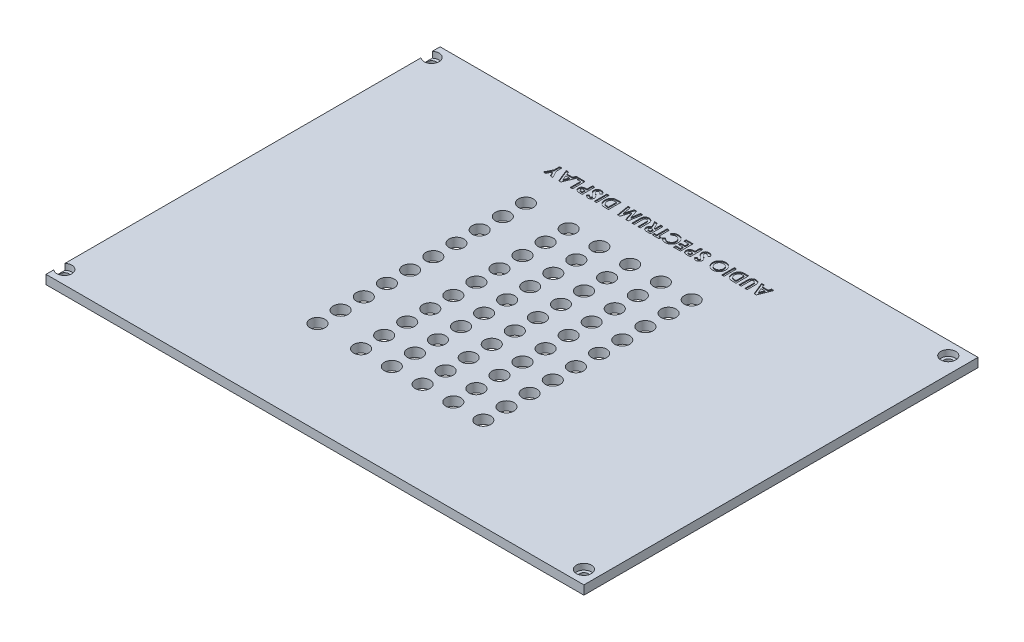
from build123d import *

# Parameters (mm, degrees)
SKETCH1_W           = 180.16
SKETCH1_H           = 132
BOSS_EXTRUDE1_DEPTH = 3
SKETCH2_R           = 2.5
CUT_EXTRUDE1_DEPTH  = 2
SKETCH3_R           = 1.5
CUT_EXTRUDE2_DEPTH  = 2
SKETCH4_R           = 2.5
CUT_EXTRUDE3_DEPTH  = 12
SKETCH6_R           = 2.5
CUT_EXTRUDE4_DEPTH  = 12
SKETCH11_R          = 2.5
CUT_EXTRUDE8_DEPTH  = 12
SKETCH12_W          = 0.75982906
SKETCH12_H          = 4.233333334
SKETCH12_W_2        = 0.759829059
CUT_EXTRUDE9_DEPTH  = 0.3


with BuildPart() as part:
    # Sketch1 → Boss-Extrude1 (new body)
    with BuildSketch(Plane(origin=(0, 0, 0), x_dir=(1, 0, 0), z_dir=(0, 1, 0))):
        Rectangle(SKETCH1_W, SKETCH1_H)
    extrude(amount=BOSS_EXTRUDE1_DEPTH)

    # Sketch2 → Cut-Extrude1 (cut)
    with BuildSketch(Plane(origin=(0, 3, 0), x_dir=(1, 0, 0), z_dir=(0, 1, 0))):
        with Locations((-88.42, 61.5)):
            Circle(SKETCH2_R)
        with Locations(Location((84.621811473, 61.5, 0), (0, 0, 270))):
            Circle(SKETCH2_R)
        with Locations(Location((85.58, -61.5, 0), (0, 0, 270))):
            Circle(SKETCH2_R)
        with Locations((-88.42, -61.5)):
            Circle(SKETCH2_R)
    extrude(amount=-CUT_EXTRUDE1_DEPTH, mode=Mode.SUBTRACT)

    # Sketch3 → Cut-Extrude2 (cut)
    with BuildSketch(Plane(origin=(0, 1, 0), x_dir=(1, 0, 0), z_dir=(0, 1, 0))):
        with Locations(Location((-88.42, 61.5, 0), (0, 0, 270))):
            Circle(SKETCH3_R)
        with Locations(Location((84.621811473, 61.5, 0), (0, 0, 270))):
            Circle(SKETCH3_R)
        with Locations(Location((85.58, -61.5, 0), (0, 0, 270))):
            Circle(SKETCH3_R)
        with Locations(Location((-88.42, -61.5, 0), (0, 0, 270))):
            Circle(SKETCH3_R)
    extrude(amount=-CUT_EXTRUDE2_DEPTH, mode=Mode.SUBTRACT)

    # Sketch4 → Cut-Extrude3 (cut)
    with BuildSketch(Plane(origin=(0, 3, 0), x_dir=(1, 0, 0), z_dir=(0, 1, 0))):
        with Locations(Location((-15.729729156, 34.699227975, 0), (0, 0, 270))):
            Circle(SKETCH4_R)
        with Locations(Location((-15.729729156, 26.97510648, 0), (0, 0, 270))):
            Circle(SKETCH4_R)
        with Locations(Location((-15.729729156, 19.250984984, 0), (0, 0, 270))):
            Circle(SKETCH4_R)
        with Locations(Location((-15.729729156, 11.526863489, 0), (0, 0, 270))):
            Circle(SKETCH4_R)
        with Locations(Location((-15.729729156, 3.802741993, 0), (0, 0, 270))):
            Circle(SKETCH4_R)
        with Locations(Location((-15.729729156, -3.921379502, 0), (0, 0, 270))):
            Circle(SKETCH4_R)
        with Locations(Location((-15.729729156, -11.645500997, 0), (0, 0, 270))):
            Circle(SKETCH4_R)
        with Locations(Location((-15.729729156, -19.369622493, 0), (0, 0, 270))):
            Circle(SKETCH4_R)
        with Locations(Location((-15.729729156, -27.093743988, 0), (0, 0, 270))):
            Circle(SKETCH4_R)
        with Locations(Location((-15.729729156, -34.817865484, 0), (0, 0, 270))):
            Circle(SKETCH4_R)
        with Locations(Location((-5.431641817, 34.699227975, 0), (0, 0, 270))):
            Circle(SKETCH4_R)
        with Locations(Location((-5.431641817, 26.97510648, 0), (0, 0, 270))):
            Circle(SKETCH4_R)
        with Locations(Location((-5.431641817, 19.250984984, 0), (0, 0, 270))):
            Circle(SKETCH4_R)
        with Locations(Location((-5.431641817, 11.526863489, 0), (0, 0, 270))):
            Circle(SKETCH4_R)
        with Locations(Location((-5.431641817, 3.802741993, 0), (0, 0, 270))):
            Circle(SKETCH4_R)
        with Locations(Location((-5.431641817, -3.921379502, 0), (0, 0, 270))):
            Circle(SKETCH4_R)
        with Locations(Location((-5.431641817, -11.645500997, 0), (0, 0, 270))):
            Circle(SKETCH4_R)
        with Locations(Location((-5.431641817, -19.369622493, 0), (0, 0, 270))):
            Circle(SKETCH4_R)
        with Locations(Location((-5.431641817, -27.093743988, 0), (0, 0, 270))):
            Circle(SKETCH4_R)
        with Locations(Location((-5.431641817, -34.817865484, 0), (0, 0, 270))):
            Circle(SKETCH4_R)
        with Locations(Location((4.866445523, 34.699227975, 0), (0, 0, 270))):
            Circle(SKETCH4_R)
        with Locations(Location((4.866445523, 26.97510648, 0), (0, 0, 270))):
            Circle(SKETCH4_R)
        with Locations(Location((4.866445523, 19.250984984, 0), (0, 0, 270))):
            Circle(SKETCH4_R)
        with Locations(Location((4.866445523, 11.526863489, 0), (0, 0, 270))):
            Circle(SKETCH4_R)
        with Locations(Location((4.866445523, 3.802741993, 0), (0, 0, 270))):
            Circle(SKETCH4_R)
        with Locations(Location((4.866445523, -3.921379502, 0), (0, 0, 270))):
            Circle(SKETCH4_R)
        with Locations(Location((4.866445523, -11.645500997, 0), (0, 0, 270))):
            Circle(SKETCH4_R)
        with Locations(Location((4.866445523, -19.369622493, 0), (0, 0, 270))):
            Circle(SKETCH4_R)
        with Locations(Location((4.866445523, -27.093743988, 0), (0, 0, 270))):
            Circle(SKETCH4_R)
        with Locations(Location((4.866445523, -34.817865484, 0), (0, 0, 270))):
            Circle(SKETCH4_R)
        with Locations(Location((15.164532862, 34.699227975, 0), (0, 0, 270))):
            Circle(SKETCH4_R)
        with Locations(Location((15.164532862, 26.97510648, 0), (0, 0, 270))):
            Circle(SKETCH4_R)
        with Locations(Location((15.164532862, 19.250984984, 0), (0, 0, 270))):
            Circle(SKETCH4_R)
        with Locations(Location((15.164532862, 11.526863489, 0), (0, 0, 270))):
            Circle(SKETCH4_R)
        with Locations(Location((15.164532862, 3.802741993, 0), (0, 0, 270))):
            Circle(SKETCH4_R)
        with Locations(Location((15.164532862, -3.921379502, 0), (0, 0, 270))):
            Circle(SKETCH4_R)
        with Locations(Location((15.164532862, -11.645500997, 0), (0, 0, 270))):
            Circle(SKETCH4_R)
        with Locations(Location((15.164532862, -19.369622493, 0), (0, 0, 270))):
            Circle(SKETCH4_R)
        with Locations(Location((15.164532862, -27.093743988, 0), (0, 0, 270))):
            Circle(SKETCH4_R)
        with Locations(Location((15.164532862, -34.817865484, 0), (0, 0, 270))):
            Circle(SKETCH4_R)
    extrude(amount=-CUT_EXTRUDE3_DEPTH, mode=Mode.SUBTRACT)

    # Sketch6 → Cut-Extrude4 (cut)
    with BuildSketch(Plane(origin=(0, 3, 0), x_dir=(1, 0, 0), z_dir=(0, 1, 0))):
        with Locations(Location((25.472183505, 34.720813868, 0), (0, 0, 270))):
            Circle(SKETCH6_R)
        with Locations(Location((25.472183505, 26.965257098, 0), (0, 0, 270))):
            Circle(SKETCH6_R)
        with Locations(Location((25.472183505, 19.209700328, 0), (0, 0, 270))):
            Circle(SKETCH6_R)
        with Locations(Location((25.472183505, 11.454143558, 0), (0, 0, 270))):
            Circle(SKETCH6_R)
        with Locations(Location((25.472183505, 3.698586787, 0), (0, 0, 270))):
            Circle(SKETCH6_R)
        with Locations(Location((25.472183505, -4.056969983, 0), (0, 0, 270))):
            Circle(SKETCH6_R)
        with Locations(Location((25.472183505, -11.812526753, 0), (0, 0, 270))):
            Circle(SKETCH6_R)
        with Locations(Location((25.472183505, -19.568083523, 0), (0, 0, 270))):
            Circle(SKETCH6_R)
        with Locations(Location((25.472183505, -27.323640293, 0), (0, 0, 270))):
            Circle(SKETCH6_R)
        with Locations(Location((25.472183505, -35.079197063, 0), (0, 0, 270))):
            Circle(SKETCH6_R)
    extrude(amount=-CUT_EXTRUDE4_DEPTH, mode=Mode.SUBTRACT)

    # Sketch11 → Cut-Extrude8 (cut)
    with BuildSketch(Plane(origin=(0, 3, 0), x_dir=(1, 0, 0), z_dir=(0, 1, 0))):
        with Locations(Location((-30.34288809, -34.817865484, 0), (0, 0, 270))):
            Circle(SKETCH11_R)
        with Locations(Location((-30.34288809, -27.057865484, 0), (0, 0, 270))):
            Circle(SKETCH11_R)
        with Locations(Location((-30.34288809, -19.297865484, 0), (0, 0, 270))):
            Circle(SKETCH11_R)
        with Locations(Location((-30.34288809, -11.537865484, 0), (0, 0, 270))):
            Circle(SKETCH11_R)
        with Locations(Location((-30.34288809, -3.777865484, 0), (0, 0, 270))):
            Circle(SKETCH11_R)
        with Locations(Location((-30.34288809, 3.982134516, 0), (0, 0, 270))):
            Circle(SKETCH11_R)
        with Locations(Location((-30.34288809, 11.742134516, 0), (0, 0, 270))):
            Circle(SKETCH11_R)
        with Locations(Location((-30.34288809, 19.502134516, 0), (0, 0, 270))):
            Circle(SKETCH11_R)
        with Locations(Location((-30.34288809, 27.262134516, 0), (0, 0, 270))):
            Circle(SKETCH11_R)
        with Locations(Location((-30.34288809, 35.022134516, 0), (0, 0, 270))):
            Circle(SKETCH11_R)
    extrude(amount=-CUT_EXTRUDE8_DEPTH, mode=Mode.SUBTRACT)

    # Sketch12 → Cut-Extrude9 (cut)
    # profile 1 of 20: a face of its own
    with BuildSketch(Plane(origin=(0, 3, 0), x_dir=(1, 0, 0), z_dir=(0, 1, 0))):
        Polygon((34.830873966, 46.976294641), (34.126166434, 46.976294641), (32.416551049, 51.209627975), (33.228109543, 51.209627975), (33.557142662, 50.341251906), (35.401593784, 50.341251906), (35.730626904, 51.209627975), (36.541337374, 51.209627975), align=None)
        Polygon((34.478944211, 48.111798114), (35.113265793, 49.581422847), (33.84462263, 49.581422847), align=None, mode=Mode.SUBTRACT)
    # profile 2 of 20: a face of its own
    with BuildSketch(Plane(origin=(0, 3, 0), x_dir=(1, 0, 0), z_dir=(0, 1, 0))):
        with BuildLine():
            Line((31.79240575, 46.976294641), (31.03257669, 46.976294641))
            Line((31.03257669, 46.976294641), (31.03257669, 49.730674983))
            add(Edge.make_bspline(
                [(31.03257669, 49.730674983), (31.032533694, 49.759231007), (31.032450648, 49.814386672), (31.02847812, 49.893520159), (31.024734063, 49.966530142), (31.018363668, 50.032824814), (31.008371254, 50.092609969), (30.99904193, 50.14610587), (30.986251254, 50.192835774), (30.967097158, 50.246063038), (30.937193286, 50.305858162), (30.889763102, 50.368884677), (30.83312343, 50.424983597), (30.76642156, 50.472086866), (30.691951239, 50.511927354), (30.608244867, 50.5382785), (30.518023618, 50.556152009), (30.455166406, 50.557600942), (30.42284779, 50.558345924)],
                knots=[0, 0, 0, 0, 1.155195489, 2.231248153, 3.20507519, 4.113220553, 4.92363642, 5.657123012, 6.309133385, 6.880755525, 7.944644177, 8.999147208, 10.058600405, 11.156792429, 12.29246015, 13.460660758, 14.694375292, 16, 16, 16, 16], degree=3))
            add(Edge.make_bspline(
                [(30.42284779, 50.558345924), (30.388546434, 50.557355895), (30.321664597, 50.555425507), (30.225270269, 50.536068175), (30.135711802, 50.505963085), (30.0554361, 50.462118818), (29.984153549, 50.410362172), (29.925014185, 50.349929958), (29.876308873, 50.283910617), (29.845691828, 50.221752275), (29.827933429, 50.165084752), (29.816300275, 50.114017687), (29.806382993, 50.054540231), (29.797666118, 49.986396467), (29.792592195, 49.909353153), (29.786883014, 49.823749436), (29.784825778, 49.729553405), (29.784471064, 49.663963367), (29.784286092, 49.629760186)],
                knots=[0, 0, 0, 0, 1.260834212, 2.45841325, 3.603280198, 4.724942815, 5.811019112, 6.833506895, 7.823953325, 8.819576102, 9.365694356, 10.006623749, 10.745436914, 11.584131356, 12.533575865, 13.586103333, 14.74122738, 16, 16, 16, 16], degree=3))
            Line((29.784286092, 49.629760186), (29.784286092, 46.976294641))
            Line((29.784286092, 46.976294641), (29.024457032, 46.976294641))
            Line((29.024457032, 46.976294641), (29.024457032, 49.501708637))
            add(Edge.make_bspline(
                [(29.024457032, 49.501708637), (29.024548891, 49.55287435), (29.024725528, 49.651261025), (29.028021392, 49.792634526), (29.034059036, 49.921826574), (29.041553664, 50.038603), (29.050541228, 50.143297396), (29.062172699, 50.235856356), (29.076401283, 50.316230244), (29.097725962, 50.40771547), (29.134477207, 50.513060092), (29.193743275, 50.634360557), (29.268977873, 50.75311358), (29.35788207, 50.868051293), (29.458340669, 50.974708145), (29.567656909, 51.068655015), (29.685238232, 51.146508713), (29.810273803, 51.210144889), (29.945085418, 51.258697694), (30.0896119, 51.292858095), (30.244373179, 51.31486813), (30.350970103, 51.317050604), (30.40588732, 51.318174983)],
                knots=[0, 0, 0, 0, 1.170912322, 2.251550202, 3.235884933, 4.130507595, 4.929373885, 5.640290569, 6.26461063, 6.796528574, 7.788739464, 8.810047518, 9.879767716, 11.000329969, 12.130634485, 13.227340211, 14.291294104, 15.350161901, 16.430664233, 17.561930962, 18.743941553, 20, 20, 20, 20], degree=3))
            add(Edge.make_bspline(
                [(30.40588732, 51.318174983), (30.442378709, 51.317558494), (30.51437547, 51.316342172), (30.620269048, 51.305675494), (30.72259882, 51.289822702), (30.82142901, 51.267161012), (30.916382596, 51.236163492), (31.007970467, 51.199847581), (31.096289069, 51.157510822), (31.17934941, 51.107053309), (31.258883781, 51.053334793), (31.332852147, 50.995547177), (31.400925185, 50.934407207), (31.463045535, 50.869819565), (31.519210055, 50.801805967), (31.569434163, 50.730375465), (31.613608595, 50.655491573), (31.652854714, 50.575816025), (31.686441846, 50.487295521), (31.714771322, 50.386784813), (31.73939874, 50.272970122), (31.758041798, 50.145101698), (31.774473331, 50.003761734), (31.78512029, 49.848410845), (31.790615966, 49.679551704), (31.79179408, 49.562487583), (31.79240575, 49.501708637)],
                knots=[0, 0, 0, 0, 1.001274302, 1.975493657, 2.918061388, 3.842055805, 4.754744607, 5.656586832, 6.54484551, 7.438946169, 8.321187755, 9.177850665, 10.012845812, 10.830395126, 11.634995211, 12.431362049, 13.224358528, 14.018909421, 14.866105371, 15.818803578, 16.882454076, 18.059767828, 19.363726729, 20.787034531, 22.331848803, 24, 24, 24, 24], degree=3))
            Line((31.79240575, 49.501708637), (31.79240575, 46.976294641))
        make_face()
    # profile 3 of 20: a face of its own
    with BuildSketch(Plane(origin=(0, 3, 0), x_dir=(1, 0, 0), z_dir=(0, 1, 0))):
        with BuildLine():
            Line((28.047533955, 46.976294641), (27.090115419, 46.976294641))
            add(Edge.make_bspline(
                [(27.090115419, 46.976294641), (27.015471814, 46.97680437), (26.871184881, 46.977789682), (26.662171213, 46.989316124), (26.467669761, 47.006242184), (26.28812052, 47.032146758), (26.122876919, 47.062213066), (25.973158714, 47.10247824), (25.837747437, 47.148685993), (25.715221951, 47.202524401), (25.60367361, 47.26566439), (25.49850587, 47.336599549), (25.398504626, 47.416394072), (25.303115692, 47.505233711), (25.212106601, 47.602527774), (25.127613718, 47.710235359), (25.04692826, 47.825566695), (24.971359358, 47.948922068), (24.904093596, 48.080057946), (24.844219527, 48.216910342), (24.794333613, 48.359568202), (24.753714731, 48.507834552), (24.721359546, 48.6612799), (24.698715551, 48.820196616), (24.684718254, 48.984442344), (24.683298239, 49.095759557), (24.68257669, 49.152322953)],
                knots=[0, 0, 0, 0, 1.44349102, 2.790284463, 4.047513061, 5.218094321, 6.297837468, 7.293772999, 8.213586047, 9.062895527, 9.878013142, 10.689252941, 11.514048747, 12.349645483, 13.208421871, 14.087867281, 14.994836234, 15.929653487, 16.883274053, 17.843080533, 18.816554169, 19.803369425, 20.81449504, 21.847452076, 22.906230055, 24, 24, 24, 24], degree=3))
            add(Edge.make_bspline(
                [(24.68257669, 49.152322953), (24.684465905, 49.232137693), (24.688184934, 49.389257679), (24.719515349, 49.619828026), (24.770178976, 49.840858164), (24.841445476, 50.050593594), (24.929696763, 50.247258369), (25.035388575, 50.426912953), (25.155484851, 50.58992355), (25.291051306, 50.733585479), (25.437604923, 50.857820866), (25.590500222, 50.962979951), (25.749600417, 51.047389282), (25.890085211, 51.100100681), (26.012246159, 51.133230012), (26.119343492, 51.152475936), (26.241229518, 51.170325742), (26.378363618, 51.185668121), (26.531152456, 51.19617462), (26.699122902, 51.203430099), (26.882315641, 51.208821382), (27.009548842, 51.209352065), (27.075699019, 51.209627975)],
                knots=[0, 0, 0, 0, 1.315347898, 2.589339334, 3.828278609, 5.048487211, 6.235212834, 7.375728391, 8.47833097, 9.56625089, 10.624194351, 11.640157642, 12.619895326, 13.585848527, 14.106971868, 14.704705962, 15.37825295, 16.137840974, 16.978850452, 17.902510282, 18.909488129, 20, 20, 20, 20], degree=3))
            Line((27.075699019, 51.209627975), (28.047533955, 51.209627975))
            Line((28.047533955, 51.209627975), (28.047533955, 46.976294641))
        make_face()
        with BuildLine():
            Line((27.287704895, 47.736123701), (27.287704895, 50.449798915))
            Line((27.287704895, 50.449798915), (26.890829895, 50.449798915))
            add(Edge.make_bspline(
                [(26.890829895, 50.449798915), (26.843616052, 50.449570286), (26.752821866, 50.449130624), (26.621575459, 50.443089715), (26.500452877, 50.433279995), (26.389295464, 50.418769943), (26.287847679, 50.401310636), (26.196479575, 50.379715775), (26.115011066, 50.353454779), (26.04277033, 50.322505929), (25.976816133, 50.287170952), (25.915714904, 50.245910593), (25.856744764, 50.200057251), (25.800995647, 50.148303842), (25.748259824, 50.091324418), (25.698849142, 50.028828332), (25.65210127, 49.961006143), (25.609228163, 49.887496565), (25.570013514, 49.809087211), (25.535368389, 49.726493344), (25.50612156, 49.639264701), (25.483911443, 49.547439892), (25.46499135, 49.451588731), (25.451329592, 49.351094924), (25.443886619, 49.24628679), (25.442904186, 49.174948138), (25.44240575, 49.138754577)],
                knots=[0, 0, 0, 0, 1.502729547, 2.8898115, 4.181010027, 5.369596896, 6.45687185, 7.456390247, 8.355533714, 9.177830239, 9.954819978, 10.733423081, 11.521791071, 12.330436719, 13.151797389, 13.990712567, 14.864234656, 15.771624029, 16.697123225, 17.652960569, 18.620374037, 19.622036587, 20.657870943, 21.729319508, 22.8479736, 24, 24, 24, 24], degree=3))
            add(Edge.make_bspline(
                [(25.44240575, 49.138754577), (25.443414647, 49.08329322), (25.445381919, 48.97514787), (25.464472457, 48.817652838), (25.495232884, 48.669533298), (25.540042324, 48.531169756), (25.595146217, 48.401682572), (25.66521197, 48.282740351), (25.745983079, 48.172393502), (25.809891597, 48.107672367), (25.84182482, 48.075333103)],
                knots=[0, 0, 0, 0, 1.138242922, 2.219485503, 3.251901297, 4.239342788, 5.201071, 6.134757343, 7.067992642, 8, 8, 8, 8], degree=3))
            add(Edge.make_bspline(
                [(25.84182482, 48.075333103), (25.873311379, 48.047774744), (25.93761911, 47.991489915), (26.050522352, 47.924046297), (26.174935878, 47.864790467), (26.313705896, 47.817807203), (26.465491255, 47.780650834), (26.631195992, 47.755024995), (26.809932722, 47.738558103), (26.933757364, 47.736952554), (26.997680857, 47.736123701)],
                knots=[0, 0, 0, 0, 0.813307809, 1.661089106, 2.549956539, 3.493439533, 4.508053171, 5.589449661, 6.755572447, 8, 8, 8, 8], degree=3))
            Line((26.997680857, 47.736123701), (27.287704895, 47.736123701))
        make_face(mode=Mode.SUBTRACT)
    # profile 4 of 20: a face of its own
    with BuildSketch(Plane(origin=(0, 3, 0), x_dir=(1, 0, 0), z_dir=(0, 1, 0))):
        with Locations((23.651380109, 49.092961308)):
            Rectangle(SKETCH12_W, SKETCH12_H)
    # profile 5 of 20: a face of its own
    with BuildSketch(Plane(origin=(0, 3, 0), x_dir=(1, 0, 0), z_dir=(0, 1, 0))):
        with BuildLine():
            add(Edge.make_bspline(
                [(20.305079361, 46.867747633), (20.231477305, 46.869652547), (20.086170177, 46.873413278), (19.872482189, 46.904785547), (19.666529604, 46.955843329), (19.468282902, 47.02711177), (19.2784182, 47.119410792), (19.096237888, 47.231479754), (18.922241211, 47.364269607), (18.758456796, 47.515885434), (18.608270497, 47.681672597), (18.476255034, 47.858425597), (18.36419064, 48.044319533), (18.2732277, 48.239390625), (18.202192205, 48.44337092), (18.152823371, 48.656337833), (18.120991517, 48.878018647), (18.117338994, 49.028965829), (18.115482673, 49.105681661)],
                knots=[0, 0, 0, 0, 1.014151002, 2.002163778, 2.969868608, 3.93493411, 4.9003771, 5.874719092, 6.87846472, 7.912488755, 8.947011879, 9.957751389, 10.948740761, 11.933621513, 12.919426746, 13.920294397, 14.943031967, 16, 16, 16, 16], degree=3))
            add(Edge.make_bspline(
                [(18.115482673, 49.105681661), (18.117460198, 49.181532937), (18.121356976, 49.33100031), (18.151520006, 49.550640327), (18.201746885, 49.761318276), (18.271412901, 49.963106181), (18.360785335, 50.156007349), (18.471138289, 50.339395839), (18.601746741, 50.513648458), (18.74994273, 50.677697667), (18.91208712, 50.827574127), (19.084849035, 50.959147249), (19.266623429, 51.069812389), (19.456248916, 51.161666831), (19.655514399, 51.23069283), (19.862210634, 51.282358995), (20.078066698, 51.312235217), (20.224709907, 51.316175149), (20.299143196, 51.318174983)],
                knots=[0, 0, 0, 0, 1.051517626, 2.07204922, 3.067438659, 4.05042616, 5.027204762, 6.009981242, 7.012629434, 8.042243656, 9.071350414, 10.070091277, 11.048190212, 12.017682766, 12.985867053, 13.966945899, 14.968060614, 16, 16, 16, 16], degree=3))
            add(Edge.make_bspline(
                [(20.299143196, 51.318174983), (20.376997517, 51.316402064), (20.529970616, 51.31291852), (20.753903003, 51.28007106), (20.968143804, 51.229990733), (21.172105994, 51.157486469), (21.365631017, 51.063277273), (21.549586748, 50.949526857), (21.722589678, 50.814037978), (21.884063138, 50.660897209), (22.030341442, 50.493284162), (22.159465192, 50.316227119), (22.268382822, 50.131065058), (22.357099925, 49.937714856), (22.427040852, 49.737377214), (22.476376248, 49.528832263), (22.505519839, 49.312580103), (22.509579373, 49.165697316), (22.511636519, 49.091265261)],
                knots=[0, 0, 0, 0, 1.067953136, 2.098381936, 3.099641766, 4.083805132, 5.062469929, 6.048665414, 7.046702845, 8.073106546, 9.098695993, 10.09591865, 11.076726721, 12.041940862, 13.011263376, 13.984305721, 14.978557872, 16, 16, 16, 16], degree=3))
            add(Edge.make_bspline(
                [(22.511636519, 49.091265261), (22.51098196, 49.041193442), (22.509681131, 48.941683829), (22.494355327, 48.794177383), (22.471625287, 48.649761489), (22.440508407, 48.508164576), (22.398583624, 48.369751549), (22.347627454, 48.234173269), (22.288247456, 48.101430485), (22.219771993, 47.972723668), (22.142312582, 47.849592726), (22.059606831, 47.730962225), (21.968486934, 47.619946452), (21.870833647, 47.5153395), (21.766264469, 47.417619554), (21.654597282, 47.326452941), (21.536007848, 47.242072187), (21.411778871, 47.163780015), (21.282335307, 47.095208238), (21.150756864, 47.033052941), (21.015780403, 46.982657444), (20.878385945, 46.940918307), (20.738889373, 46.907420954), (20.59621365, 46.88514807), (20.451562927, 46.869701191), (20.354023095, 46.868400364), (20.305079361, 46.867747633)],
                knots=[0, 0, 0, 0, 1.034641744, 2.056182551, 3.061960284, 4.05571729, 5.050247014, 6.048716841, 7.047801973, 8.054190544, 9.059424999, 10.053182006, 11.041513076, 12.025412457, 13.009311837, 13.997642908, 15.002928308, 16.016213968, 17.030509951, 18.02913364, 19.022134519, 20.005478534, 20.996155877, 21.984625117, 22.988721131, 24, 24, 24, 24], degree=3))
        make_face()
        with BuildLine():
            add(Edge.make_bspline(
                [(20.31695169, 47.627576693), (20.366485614, 47.628905801), (20.464245758, 47.631528928), (20.607642128, 47.651513564), (20.745307549, 47.683431423), (20.876479627, 47.729663609), (21.00172414, 47.788507032), (21.121273333, 47.859748967), (21.233432933, 47.94586551), (21.339848002, 48.04213036), (21.435652323, 48.14983461), (21.521793385, 48.264000511), (21.591441929, 48.387375086), (21.651329734, 48.51589471), (21.695566141, 48.652809508), (21.729247552, 48.795897363), (21.747592673, 48.946627176), (21.750382515, 49.049101548), (21.751807459, 49.101441543)],
                knots=[0, 0, 0, 0, 1.033668485, 2.040047952, 3.016132939, 3.979056467, 4.937231767, 5.900589077, 6.877725736, 7.88429546, 8.891280164, 9.882584218, 10.863295226, 11.842887319, 12.837417301, 13.860812229, 14.907384602, 16, 16, 16, 16], degree=3))
            add(Edge.make_bspline(
                [(21.751807459, 49.101441543), (21.75007537, 49.159462184), (21.746680761, 49.273173027), (21.72314336, 49.439140263), (21.681901245, 49.595699514), (21.625559546, 49.743374524), (21.550665357, 49.880612406), (21.461090216, 50.009076937), (21.354591358, 50.127971064), (21.272689683, 50.197444243), (21.231121028, 50.232704898)],
                knots=[0, 0, 0, 0, 1.078343132, 2.113373867, 3.107373148, 4.082093053, 5.043582658, 6.005574554, 6.987742499, 8, 8, 8, 8], degree=3))
            add(Edge.make_bspline(
                [(21.231121028, 50.232704898), (21.197059291, 50.258749985), (21.129703234, 50.310253358), (21.022188302, 50.376265496), (20.911469093, 50.432844484), (20.796710092, 50.478559637), (20.678153663, 50.514518408), (20.555816064, 50.539699744), (20.429870638, 50.55550321), (20.344700439, 50.557392023), (20.301687267, 50.558345924)],
                knots=[0, 0, 0, 0, 1.023928204, 2.024787132, 3.009472467, 3.9914905, 4.972207045, 5.96565515, 6.972602802, 8, 8, 8, 8], degree=3))
            add(Edge.make_bspline(
                [(20.301687267, 50.558345924), (20.253006022, 50.557003644), (20.157224142, 50.554362668), (20.016483719, 50.534651211), (19.881712661, 50.501146323), (19.751661783, 50.4556479), (19.628072564, 50.394672132), (19.509017723, 50.322268083), (19.395916189, 50.236177628), (19.290146741, 50.137486824), (19.193214697, 50.029777493), (19.107456813, 49.914994081), (19.036435147, 49.79313212), (18.977194038, 49.665819423), (18.931038618, 49.532042314), (18.899451927, 49.391790704), (18.879151765, 49.245630443), (18.87660775, 49.146172835), (18.875311733, 49.095505379)],
                knots=[0, 0, 0, 0, 1.026350473, 2.019376834, 2.989435443, 3.95094063, 4.91865229, 5.889827372, 6.885283771, 7.910196595, 8.935871797, 9.9372888, 10.925850568, 11.904605667, 12.894245083, 13.903507864, 14.931967858, 16, 16, 16, 16], degree=3))
            add(Edge.make_bspline(
                [(18.875311733, 49.095505379), (18.876647572, 49.045127196), (18.879276967, 48.945965426), (18.899098886, 48.800210632), (18.932052153, 48.660729658), (18.978625651, 48.527162958), (19.036646538, 48.398809316), (19.109530431, 48.276782734), (19.195697536, 48.161188784), (19.293572645, 48.052714687), (19.400086163, 47.953027259), (19.514443686, 47.866518395), (19.633439892, 47.7913445), (19.759806566, 47.732456413), (19.89095798, 47.685540371), (20.027694527, 47.650990731), (20.170534078, 47.631669317), (20.267710778, 47.628953061), (20.31695169, 47.627576693)],
                knots=[0, 0, 0, 0, 1.055040155, 2.076685641, 3.074845078, 4.052329834, 5.035358467, 6.020382375, 7.023447318, 8.050688466, 9.077178457, 10.074336316, 11.0503314, 12.019748348, 12.988025369, 13.964577102, 14.968620271, 16, 16, 16, 16], degree=3))
        make_face(mode=Mode.SUBTRACT)
    # profile 6 of 20: a face of its own
    with BuildSketch(Plane(origin=(0, 3, 0), x_dir=(1, 0, 0), z_dir=(0, 1, 0))):
        with BuildLine():
            Line((13.556508314, 47.541926319), (14.124684062, 48.061764727))
            add(Edge.make_bspline(
                [(14.124684062, 48.061764727), (14.149017591, 48.027427014), (14.195734574, 47.961503395), (14.271534048, 47.873326478), (14.346880673, 47.797611541), (14.423314989, 47.73652336), (14.499521037, 47.68734545), (14.577117854, 47.653425463), (14.655212743, 47.631611316), (14.707708009, 47.628908155), (14.733564938, 47.627576693)],
                knots=[0, 0, 0, 0, 1.299459705, 2.494781419, 3.587730629, 4.594196874, 5.512431013, 6.380462003, 7.202284646, 8, 8, 8, 8], degree=3))
            add(Edge.make_bspline(
                [(14.733564938, 47.627576693), (14.757693419, 47.628397312), (14.804279176, 47.629981713), (14.87038129, 47.646523044), (14.929785207, 47.673252944), (14.980908566, 47.710176037), (15.022036197, 47.754272924), (15.054015386, 47.801216212), (15.072598555, 47.852399854), (15.074985001, 47.887502491), (15.076166434, 47.904880379)],
                knots=[0, 0, 0, 0, 1.184157716, 2.286297433, 3.324836695, 4.370048774, 5.362957217, 6.276446515, 7.146738784, 8, 8, 8, 8], degree=3))
            add(Edge.make_bspline(
                [(15.076166434, 47.904880379), (15.075418588, 47.922500706), (15.073912532, 47.957985598), (15.059366081, 48.009993126), (15.037440425, 48.060810534), (15.016489565, 48.091745509), (15.005780483, 48.107557996)],
                knots=[0, 0, 0, 0, 0.967525499, 1.948461899, 2.951351359, 4, 4, 4, 4], degree=3))
            add(Edge.make_bspline(
                [(15.005780483, 48.107557996), (14.996005508, 48.119812311), (14.973374795, 48.148183116), (14.931534093, 48.19383567), (14.876824856, 48.247429229), (14.811559424, 48.311664222), (14.733288508, 48.384045531), (14.643692619, 48.466668877), (14.540778353, 48.556727605), (14.468676405, 48.620304961), (14.430820547, 48.653685133)],
                knots=[0, 0, 0, 0, 0.473849886, 1.097042329, 1.870584189, 2.789244661, 3.865562256, 5.093556389, 6.47402294, 8, 8, 8, 8], degree=3))
            add(Edge.make_bspline(
                [(14.430820547, 48.653685133), (14.395202234, 48.684495229), (14.327606075, 48.742966391), (14.231552058, 48.826093292), (14.146586955, 48.900544881), (14.073483489, 48.966878674), (14.010057156, 49.022362962), (13.959113156, 49.070411212), (13.918471193, 49.108921523), (13.895391321, 49.132208428), (13.885541434, 49.142146671)],
                knots=[0, 0, 0, 0, 1.543627419, 2.929484142, 4.163674036, 5.24627963, 6.164986907, 6.925413438, 7.541394495, 8, 8, 8, 8], degree=3))
            add(Edge.make_bspline(
                [(13.885541434, 49.142146671), (13.848149973, 49.182580476), (13.776270453, 49.260308449), (13.683035539, 49.381088442), (13.605473104, 49.498082837), (13.545408939, 49.614595362), (13.50184775, 49.73303386), (13.470136749, 49.855088154), (13.451129065, 49.982503378), (13.449025348, 50.069255233), (13.447961305, 50.113133584)],
                knots=[0, 0, 0, 0, 1.206413378, 2.319150186, 3.339784753, 4.27899982, 5.184598145, 6.099639703, 7.038813909, 8, 8, 8, 8], degree=3))
            add(Edge.make_bspline(
                [(13.447961305, 50.113133584), (13.448719595, 50.155888007), (13.450207387, 50.239773776), (13.468410257, 50.3625338), (13.494403584, 50.479998681), (13.534456236, 50.590991657), (13.583684099, 50.696828086), (13.643680993, 50.797543558), (13.717033192, 50.89078677), (13.798506104, 50.97907368), (13.890032327, 51.058320385), (13.988452488, 51.128186579), (14.093954017, 51.187176357), (14.205732916, 51.235790014), (14.325191073, 51.271866714), (14.450441337, 51.299142801), (14.582745653, 51.315588993), (14.673025805, 51.317300567), (14.719148538, 51.318174983)],
                knots=[0, 0, 0, 0, 1.043039441, 2.046482205, 3.024244422, 3.976033659, 4.920890471, 5.871402525, 6.830893638, 7.812473116, 8.800703348, 9.781190227, 10.754606487, 11.746997808, 12.751247331, 13.796362838, 14.874195872, 16, 16, 16, 16], degree=3))
            add(Edge.make_bspline(
                [(14.719148538, 51.318174983), (14.755355023, 51.317533357), (14.827064626, 51.316262568), (14.932748749, 51.305866321), (15.034817841, 51.289140768), (15.133068039, 51.264983385), (15.228120835, 51.235072464), (15.318944698, 51.196177579), (15.406747185, 51.152192606), (15.491236304, 51.101221145), (15.571711936, 51.04202274), (15.650492733, 50.976933917), (15.724785839, 50.90238483), (15.797429789, 50.821093195), (15.865390615, 50.730702985), (15.932249486, 50.633934124), (15.994743211, 50.528473295), (16.033363251, 50.454506563), (16.05308951, 50.416725998)],
                knots=[0, 0, 0, 0, 1.017088714, 2.014418954, 2.980620591, 3.920647918, 4.854987948, 5.776890852, 6.693269322, 7.612671471, 8.545186947, 9.498010697, 10.480815007, 11.499174288, 12.558697099, 13.655746277, 14.802607237, 16, 16, 16, 16], degree=3))
            Line((16.05308951, 50.416725998), (15.384846989, 50.015610881))
            add(Edge.make_bspline(
                [(15.384846989, 50.015610881), (15.360174142, 50.058498193), (15.312874185, 50.140716835), (15.232719987, 50.251188002), (15.150606102, 50.345788269), (15.064634133, 50.422845573), (14.975849465, 50.483390267), (14.883823248, 50.526659705), (14.788490826, 50.553443439), (14.723554711, 50.556714351), (14.691163763, 50.558345924)],
                knots=[0, 0, 0, 0, 1.283663364, 2.460892379, 3.537111102, 4.529833553, 5.449777664, 6.316464042, 7.160231139, 8, 8, 8, 8], degree=3))
            add(Edge.make_bspline(
                [(14.691163763, 50.558345924), (14.658211463, 50.557026155), (14.594279203, 50.554465611), (14.502873854, 50.530347881), (14.418702688, 50.493330348), (14.346336861, 50.439494038), (14.284884362, 50.378104985), (14.240829236, 50.308867801), (14.212252215, 50.234854108), (14.209283472, 50.183206562), (14.207790365, 50.157230806)],
                knots=[0, 0, 0, 0, 1.13537643, 2.202795631, 3.242191317, 4.290390765, 5.297919085, 6.223733717, 7.106639842, 8, 8, 8, 8], degree=3))
            add(Edge.make_bspline(
                [(14.207790365, 50.157230806), (14.209187956, 50.133076721), (14.212027029, 50.084010009), (14.232824953, 50.011013345), (14.265611285, 49.93837064), (14.303237453, 49.878156516), (14.342464759, 49.827965539), (14.380915033, 49.785131236), (14.426485259, 49.736816683), (14.480336591, 49.684339365), (14.541421628, 49.626690311), (14.609940352, 49.564006586), (14.686630644, 49.496799155), (14.740837672, 49.451019987), (14.769181925, 49.427082569)],
                knots=[0, 0, 0, 0, 0.916057066, 1.860882232, 2.859899639, 3.934694552, 4.546382938, 5.276161949, 6.118633209, 7.067046139, 8.129668089, 9.306861125, 10.591787583, 12, 12, 12, 12], degree=3))
            add(Edge.make_bspline(
                [(14.769181925, 49.427082569), (14.823063461, 49.38149063), (14.926478436, 49.2939859), (15.072643012, 49.164769758), (15.204258688, 49.043915499), (15.320447688, 48.930456275), (15.42155515, 48.825117023), (15.508694126, 48.728822516), (15.580456495, 48.639684436), (15.654869669, 48.533219552), (15.727573522, 48.405314587), (15.789361449, 48.250707214), (15.829293961, 48.096293419), (15.833785025, 47.992454262), (15.835995493, 47.941345389)],
                knots=[0, 0, 0, 0, 1.345685333, 2.582777463, 3.719355561, 4.752181389, 5.678433858, 6.502864483, 7.227563063, 7.858499643, 8.978226409, 10.023061349, 11.026965269, 12, 12, 12, 12], degree=3))
            add(Edge.make_bspline(
                [(15.835995493, 47.941345389), (15.835075731, 47.905102573), (15.833263701, 47.833700333), (15.817147971, 47.728701431), (15.792950384, 47.627434197), (15.758176957, 47.529924256), (15.711536266, 47.437270105), (15.656445067, 47.347972118), (15.591334654, 47.262303231), (15.516711206, 47.182163833), (15.4347952, 47.108495572), (15.347423814, 47.043863338), (15.255404285, 46.989210526), (15.158457566, 46.944687218), (15.056755205, 46.909943494), (14.950203266, 46.885389542), (14.839128277, 46.870747055), (14.763572837, 46.868759897), (14.725084703, 46.867747633)],
                knots=[0, 0, 0, 0, 1.010806554, 1.991397492, 2.957573065, 3.913225829, 4.872777376, 5.846906201, 6.837692339, 7.870332167, 8.898170327, 9.907899016, 10.8981826, 11.879407896, 12.8797257, 13.891947133, 14.926152479, 16, 16, 16, 16], degree=3))
            add(Edge.make_bspline(
                [(14.725084703, 46.867747633), (14.67520894, 46.869577163), (14.575851118, 46.873221783), (14.428904232, 46.901572871), (14.285301989, 46.946628323), (14.169226258, 46.99970162), (14.077661548, 47.052752799), (14.007315159, 47.100604647), (13.93517569, 47.155554987), (13.862567497, 47.219202915), (13.786737259, 47.287869182), (13.711515214, 47.366266107), (13.633217839, 47.450376854), (13.582526099, 47.510875229), (13.556508314, 47.541926319)],
                knots=[0, 0, 0, 0, 1.282890948, 2.555655204, 3.837225328, 5.149160694, 5.83044799, 6.558852598, 7.337307105, 8.162686284, 9.043076448, 9.969084596, 10.957622644, 12, 12, 12, 12], degree=3))
        make_face()
    # profile 7 of 20: a face of its own
    with BuildSketch(Plane(origin=(0, 3, 0), x_dir=(1, 0, 0), z_dir=(0, 1, 0))):
        with BuildLine():
            Line((12.688132246, 46.976294641), (11.840108741, 46.976294641))
            add(Edge.make_bspline(
                [(11.840108741, 46.976294641), (11.784699985, 46.976542662), (11.677804881, 46.977021147), (11.52365335, 46.982823422), (11.381440997, 46.993221425), (11.251200578, 47.006071797), (11.132985367, 47.024087228), (11.026648226, 47.044741399), (10.932164184, 47.069901287), (10.848477129, 47.099774981), (10.773347537, 47.134964092), (10.702334248, 47.172549959), (10.636506061, 47.217102186), (10.574317518, 47.26540936), (10.516239043, 47.31847647), (10.461840265, 47.376093783), (10.411681339, 47.439098645), (10.36607673, 47.507057011), (10.324683593, 47.578585295), (10.288525796, 47.653846612), (10.259195081, 47.732950472), (10.234590689, 47.815387752), (10.214828087, 47.901154148), (10.201673497, 47.990777328), (10.192738231, 48.083631455), (10.191949817, 48.146828034), (10.191551049, 48.178791971)],
                knots=[0, 0, 0, 0, 1.698787518, 3.27731721, 4.728409951, 6.070286353, 7.288646904, 8.393455548, 9.389990496, 10.283725379, 11.113616976, 11.931887102, 12.744353494, 13.547053751, 14.344590688, 15.153907614, 15.974148981, 16.810666655, 17.660988447, 18.506082349, 19.367288142, 20.244738011, 21.142497992, 22.06302001, 23.020302899, 24, 24, 24, 24], degree=3))
            add(Edge.make_bspline(
                [(10.191551049, 48.178791971), (10.192125516, 48.214153937), (10.193254414, 48.283644545), (10.204404865, 48.385491792), (10.223265238, 48.482660013), (10.248513995, 48.575564312), (10.281447481, 48.664001441), (10.322724161, 48.74739044), (10.369939029, 48.826776233), (10.425678059, 48.900706848), (10.487269863, 48.969558623), (10.553590159, 49.034080838), (10.626628916, 49.091621513), (10.703779157, 49.145172115), (10.787248364, 49.191589443), (10.874563507, 49.234569955), (10.967939145, 49.271042856), (11.032918842, 49.290177737), (11.065863282, 49.299879043)],
                knots=[0, 0, 0, 0, 1.101767505, 2.165108537, 3.187936629, 4.183892551, 5.162396277, 6.123736501, 7.080098904, 8.036826416, 9.0040019, 9.957275584, 10.916231297, 11.898534744, 12.880877694, 13.889532316, 14.930001539, 16, 16, 16, 16], degree=3))
            add(Edge.make_bspline(
                [(11.065863282, 49.299879043), (11.087564825, 49.305278422), (11.134577357, 49.316975216), (11.212370183, 49.328850398), (11.302018248, 49.339768897), (11.403811442, 49.349152025), (11.517808451, 49.355530366), (11.643898896, 49.360511567), (11.78213992, 49.364133414), (11.878267261, 49.364261933), (11.928303186, 49.36432883)],
                knots=[0, 0, 0, 0, 0.618981996, 1.340914327, 2.176866532, 3.120127938, 4.170906482, 5.338178032, 6.614476169, 8, 8, 8, 8], degree=3))
            Line((11.928303186, 49.36432883), (11.928303186, 51.209627975))
            Line((11.928303186, 51.209627975), (12.688132246, 51.209627975))
            Line((12.688132246, 51.209627975), (12.688132246, 46.976294641))
        make_face()
        with BuildLine():
            Line((11.928303186, 48.60449977), (11.659479735, 48.60449977))
            add(Edge.make_bspline(
                [(11.659479735, 48.60449977), (11.610562264, 48.604190755), (11.520553392, 48.603622163), (11.397644161, 48.595356131), (11.298839545, 48.582788519), (11.220867779, 48.564616528), (11.159277932, 48.537558386), (11.106797005, 48.50492346), (11.060170981, 48.465706681), (11.021304526, 48.418691872), (10.989632121, 48.366238309), (10.967417468, 48.307949921), (10.953396532, 48.244758219), (10.952064912, 48.200634914), (10.951380109, 48.177943947)],
                knots=[0, 0, 0, 0, 1.862351722, 3.426754836, 4.68713255, 5.653025869, 6.462861518, 7.236406327, 7.999926698, 8.771672214, 9.54880311, 10.322347919, 11.137246204, 12, 12, 12, 12], degree=3))
            add(Edge.make_bspline(
                [(10.951380109, 48.177943947), (10.952043557, 48.158114187), (10.953330805, 48.119639686), (10.96291761, 48.064150492), (10.977796819, 48.012524569), (11.000536803, 47.965481569), (11.028145217, 47.921924255), (11.063169923, 47.883208577), (11.103560609, 47.848081953), (11.134796388, 47.82951229), (11.150665632, 47.820078028)],
                knots=[0, 0, 0, 0, 1.102449765, 2.139017612, 3.12397484, 4.080535277, 5.035673127, 5.982361139, 6.974944601, 8, 8, 8, 8], degree=3))
            add(Edge.make_bspline(
                [(11.150665632, 47.820078028), (11.164104402, 47.813281657), (11.19255703, 47.798892347), (11.241014615, 47.782163722), (11.296933928, 47.768051284), (11.360692487, 47.756338097), (11.432035941, 47.747247447), (11.510951562, 47.740295374), (11.597555482, 47.737499675), (11.657783325, 47.73659501), (11.689160557, 47.736123701)],
                knots=[0, 0, 0, 0, 0.656809284, 1.390599849, 2.23162475, 3.173112763, 4.218524733, 5.370385145, 6.63003504, 8, 8, 8, 8], degree=3))
            Line((11.689160557, 47.736123701), (11.928303186, 47.736123701))
            Line((11.928303186, 47.736123701), (11.928303186, 48.60449977))
        make_face(mode=Mode.SUBTRACT)
    # profile 8 of 20: a face of its own
    with BuildSketch(Plane(origin=(0, 3, 0), x_dir=(1, 0, 0), z_dir=(0, 1, 0))):
        Polygon((9.431721989, 46.976294641), (7.15223481, 46.976294641), (7.15223481, 47.736123701), (8.671892929, 47.736123701), (8.671892929, 48.550226265), (7.15223481, 48.550226265), (7.15223481, 49.310055325), (8.671892929, 49.310055325), (8.671892929, 50.449798915), (7.15223481, 50.449798915), (7.15223481, 51.209627975), (9.431721989, 51.209627975), align=None)
    # profile 9 of 20: a face of its own
    with BuildSketch(Plane(origin=(0, 3, 0), x_dir=(1, 0, 0), z_dir=(0, 1, 0))):
        with BuildLine():
            Line((2.593260451, 47.710682996), (3.150411893, 48.243241757))
            add(Edge.make_bspline(
                [(3.150411893, 48.243241757), (3.197619006, 48.194301412), (3.289979392, 48.098549968), (3.43951441, 47.973200902), (3.593242547, 47.866669928), (3.751594082, 47.779839611), (3.914478049, 47.710930374), (4.082177839, 47.66285932), (4.254288367, 47.632590938), (4.370592956, 47.629257396), (4.429231337, 47.627576693)],
                knots=[0, 0, 0, 0, 1.115370381, 2.182214363, 3.196266025, 4.180416361, 5.141116029, 6.092551847, 7.038303877, 8, 8, 8, 8], degree=3))
            add(Edge.make_bspline(
                [(4.429231337, 47.627576693), (4.478195004, 47.628930541), (4.574819405, 47.63160221), (4.71667594, 47.651235381), (4.852420496, 47.68449651), (4.982160769, 47.730729237), (5.106538209, 47.788951743), (5.224394641, 47.862133235), (5.336363438, 47.947831192), (5.441136338, 48.045895654), (5.535723603, 48.153831096), (5.620948072, 48.267506464), (5.691538908, 48.388932401), (5.749162127, 48.516338145), (5.794570549, 48.649769702), (5.826798728, 48.789220394), (5.845471757, 48.935005075), (5.848255783, 49.034112012), (5.849670707, 49.084481073)],
                knots=[0, 0, 0, 0, 1.035268443, 2.04298821, 3.02163646, 3.985902049, 4.951223231, 5.920091634, 6.913651787, 7.92868536, 8.949353712, 9.945284791, 10.92850487, 11.913014323, 12.897904816, 13.904240668, 14.934873455, 16, 16, 16, 16], degree=3))
            add(Edge.make_bspline(
                [(5.849670707, 49.084481073), (5.849257121, 49.119832567), (5.848441935, 49.189511088), (5.839743414, 49.292320136), (5.825297274, 49.392284918), (5.805035421, 49.489109253), (5.779527472, 49.583210819), (5.748308171, 49.673976682), (5.710561037, 49.761523297), (5.668315724, 49.846309258), (5.62116093, 49.927616135), (5.56830257, 50.004365715), (5.510332959, 50.075961622), (5.449571668, 50.144895144), (5.381994613, 50.207132187), (5.310627454, 50.266102724), (5.234446212, 50.320345845), (5.1535434, 50.369106681), (5.070333875, 50.414550933), (4.983112545, 50.452184628), (4.894316716, 50.486015079), (4.80238861, 50.511465757), (4.708947537, 50.533602466), (4.612692884, 50.547122044), (4.514538142, 50.557395135), (4.448199091, 50.55802763), (4.414814938, 50.558345924)],
                knots=[0, 0, 0, 0, 1.103833241, 2.175677997, 3.219414644, 4.256521947, 5.263082927, 6.262573145, 7.25136242, 8.238376666, 9.219530388, 10.184343756, 11.145312504, 12.095474572, 13.051075647, 14.010745898, 14.985684176, 15.968306307, 16.959653902, 17.943861036, 18.93268972, 19.924626761, 20.920484516, 21.929288403, 22.957944781, 24, 24, 24, 24], degree=3))
            add(Edge.make_bspline(
                [(4.414814938, 50.558345924), (4.358188688, 50.556711734), (4.246932832, 50.553500978), (4.083672927, 50.528283702), (3.927654621, 50.486989393), (3.803241223, 50.437320436), (3.705893651, 50.389035114), (3.631822443, 50.345011907), (3.555550571, 50.29514602), (3.477600247, 50.23805609), (3.397549517, 50.174421513), (3.316773587, 50.102912246), (3.233215677, 50.025864649), (3.178477282, 49.970875047), (3.150411893, 49.942680859)],
                knots=[0, 0, 0, 0, 1.404640003, 2.759752344, 4.088613405, 5.401587939, 6.076032573, 6.783413463, 7.538272532, 8.336594406, 9.180107851, 10.074881764, 11.012956238, 12, 12, 12, 12], degree=3))
            Line((3.150411893, 49.942680859), (2.610220921, 50.510008584))
            add(Edge.make_bspline(
                [(2.610220921, 50.510008584), (2.648193438, 50.546669859), (2.722307671, 50.618224828), (2.834106942, 50.719826182), (2.945765479, 50.811126384), (3.054585978, 50.895438813), (3.162350569, 50.970308677), (3.269049425, 51.035805745), (3.37346909, 51.093604066), (3.477797494, 51.142668021), (3.582862805, 51.184594301), (3.690918408, 51.219952853), (3.802015932, 51.250818446), (3.917075492, 51.275108075), (4.035583703, 51.294881515), (4.157921374, 51.307947369), (4.283516904, 51.317007716), (4.36843957, 51.317782719), (4.411422844, 51.318174983)],
                knots=[0, 0, 0, 0, 1.244537013, 2.429070097, 3.56066612, 4.644477994, 5.67429546, 6.652817684, 7.595405349, 8.486886006, 9.369351459, 10.26090686, 11.166404474, 12.086719576, 13.0323422, 13.998023148, 14.9867073, 16, 16, 16, 16], degree=3))
            add(Edge.make_bspline(
                [(4.411422844, 51.318174983), (4.49037475, 51.316158785), (4.644861683, 51.312213645), (4.871280083, 51.283083456), (5.086549931, 51.233924779), (5.291058035, 51.16534535), (5.484178514, 51.076295327), (5.666516998, 50.968243356), (5.837769836, 50.840163907), (5.996463415, 50.693965246), (6.139964332, 50.53246713), (6.266945909, 50.359128906), (6.37152309, 50.172705789), (6.460251453, 49.977191081), (6.526739883, 49.769528134), (6.575137599, 49.551593421), (6.604587357, 49.32245171), (6.607840595, 49.165979144), (6.609499767, 49.08617712)],
                knots=[0, 0, 0, 0, 1.07798487, 2.109316747, 3.111276023, 4.08905949, 5.049398091, 6.009992678, 6.978127636, 7.964347882, 8.951383687, 9.924270623, 10.892397886, 11.86520058, 12.851549246, 13.863953586, 14.910602472, 16, 16, 16, 16], degree=3))
            add(Edge.make_bspline(
                [(6.609499767, 49.08617712), (6.60877513, 49.034133135), (6.607339075, 48.930994677), (6.593181971, 48.778669378), (6.571464355, 48.630795751), (6.540555089, 48.48755567), (6.502123518, 48.348453173), (6.453205687, 48.214118072), (6.396546277, 48.08381497), (6.330397027, 47.958758182), (6.256247249, 47.838789675), (6.17518149, 47.724212689), (6.085638686, 47.61616687), (5.988469745, 47.514179657), (5.884482233, 47.417591874), (5.772659158, 47.327089014), (5.652893598, 47.243254707), (5.526407201, 47.166020053), (5.39560799, 47.095090687), (5.260403008, 47.035616588), (5.123427138, 46.983115383), (4.983752293, 46.940709012), (4.841071046, 46.908721782), (4.696472941, 46.884583189), (4.548776516, 46.871073352), (4.449609406, 46.868863268), (4.399550515, 46.867747633)],
                knots=[0, 0, 0, 0, 1.07193642, 2.124315995, 3.14887099, 4.149444713, 5.141371803, 6.119544533, 7.092241254, 8.06650569, 9.031360777, 9.996057679, 10.955696533, 11.919602115, 12.89624813, 13.877605408, 14.880920851, 15.905674436, 16.929600311, 17.943674756, 18.946313929, 19.950355855, 20.947755382, 21.956851243, 22.968632213, 24, 24, 24, 24], degree=3))
            add(Edge.make_bspline(
                [(4.399550515, 46.867747633), (4.356845471, 46.868387946), (4.271879397, 46.869661916), (4.145347168, 46.880263067), (4.019840736, 46.896959339), (3.895743358, 46.921974426), (3.772496975, 46.952268848), (3.650617586, 46.989583397), (3.530441279, 47.035098402), (3.41092622, 47.085447603), (3.294455958, 47.142767553), (3.182042699, 47.206926006), (3.073407902, 47.276244515), (2.969206456, 47.351915369), (2.868704424, 47.432827061), (2.772009041, 47.518976914), (2.680048172, 47.611927664), (2.62233594, 47.677598136), (2.593260451, 47.710682996)],
                knots=[0, 0, 0, 0, 0.996333415, 1.982307736, 2.96084097, 3.949129141, 4.93457382, 5.921430247, 6.92116383, 7.931890485, 8.946633814, 9.948019707, 10.950686436, 11.952094051, 12.951305284, 13.960287133, 14.972390273, 16, 16, 16, 16], degree=3))
        make_face()
    # profile 10 of 20: a face of its own
    with BuildSketch(Plane(origin=(0, 3, 0), x_dir=(1, 0, 0), z_dir=(0, 1, 0))):
        Polygon((2.267619425, 46.976294641), (-0.011867754, 46.976294641), (-0.011867754, 47.736123701), (0.747961305, 47.736123701), (0.747961305, 51.209627975), (1.507790365, 51.209627975), (1.507790365, 47.736123701), (2.267619425, 47.736123701), align=None)
    # profile 11 of 20: a face of its own
    with BuildSketch(Plane(origin=(0, 3, 0), x_dir=(1, 0, 0), z_dir=(0, 1, 0))):
        with BuildLine():
            Line((-0.608876301, 46.976294641), (-1.49421284, 46.976294641))
            add(Edge.make_bspline(
                [(-1.49421284, 46.976294641), (-1.552733836, 46.97649868), (-1.665286197, 46.976891103), (-1.827572218, 46.983242696), (-1.976683714, 46.991850378), (-2.112951963, 47.005793224), (-2.236221663, 47.021814715), (-2.346241435, 47.043322491), (-2.443420456, 47.067181774), (-2.528954149, 47.096541864), (-2.605956316, 47.130299431), (-2.677451183, 47.168514923), (-2.745225056, 47.212228319), (-2.808784428, 47.261299278), (-2.870085208, 47.31386418), (-2.925845407, 47.372978074), (-2.978552515, 47.43670616), (-3.027652936, 47.505052564), (-3.071738084, 47.577857746), (-3.109752675, 47.654251335), (-3.142484382, 47.733769933), (-3.168388235, 47.816704094), (-3.189046709, 47.902817721), (-3.202861214, 47.991897156), (-3.213125357, 48.084141557), (-3.213707532, 48.146819351), (-3.214004507, 48.178791971)],
                knots=[0, 0, 0, 0, 1.748592178, 3.36303531, 4.852592433, 6.210838904, 7.455605234, 8.565530618, 9.559147328, 10.443333557, 11.264119507, 12.069061813, 12.863340979, 13.67089394, 14.467102114, 15.273638367, 16.095597024, 16.937114566, 17.786018611, 18.63597263, 19.484582448, 20.352808207, 21.22970172, 22.128176732, 23.04516274, 24, 24, 24, 24], degree=3))
            add(Edge.make_bspline(
                [(-3.214004507, 48.178791971), (-3.213222844, 48.212162301), (-3.211690146, 48.277595438), (-3.203502645, 48.373724011), (-3.188281118, 48.465916094), (-3.165977198, 48.553580053), (-3.139280715, 48.63761372), (-3.104706197, 48.716705545), (-3.065389648, 48.792254653), (-3.018747468, 48.863016063), (-2.967527718, 48.930510463), (-2.908042049, 48.992286478), (-2.843651639, 49.051272544), (-2.772397046, 49.105459977), (-2.6944916, 49.15451145), (-2.611400235, 49.200419365), (-2.521974629, 49.242368319), (-2.459160237, 49.265831838), (-2.427038695, 49.277830432)],
                knots=[0, 0, 0, 0, 1.099808295, 2.156523617, 3.176426857, 4.17500812, 5.135317955, 6.078349783, 7.015890908, 7.9382699, 8.868004242, 9.803692517, 10.759882289, 11.743580734, 12.748787378, 13.791075452, 14.870417076, 16, 16, 16, 16], degree=3))
            Line((-2.427038695, 49.277830432), (-3.403961772, 51.209627975))
            Line((-3.403961772, 51.209627975), (-2.559330361, 51.209627975))
            Line((-2.559330361, 51.209627975), (-1.626504507, 49.36432883))
            Line((-1.626504507, 49.36432883), (-1.368705361, 49.36432883))
            Line((-1.368705361, 49.36432883), (-1.368705361, 51.209627975))
            Line((-1.368705361, 51.209627975), (-0.608876301, 51.209627975))
            Line((-0.608876301, 51.209627975), (-0.608876301, 46.976294641))
        make_face()
        with BuildLine():
            Line((-1.368705361, 48.60449977), (-1.664665564, 48.60449977))
            add(Edge.make_bspline(
                [(-1.664665564, 48.60449977), (-1.700849165, 48.604092252), (-1.770132986, 48.603311942), (-1.869772128, 48.599692413), (-1.960268552, 48.590971581), (-2.04200949, 48.579951983), (-2.115410728, 48.567231872), (-2.17980329, 48.548990926), (-2.236224659, 48.529480898), (-2.283864737, 48.50511878), (-2.324733426, 48.477900961), (-2.358989736, 48.445616605), (-2.389168313, 48.410250804), (-2.41284065, 48.369577619), (-2.431966373, 48.325263422), (-2.443827528, 48.276474483), (-2.453238232, 48.224094186), (-2.453854667, 48.187604268), (-2.454175447, 48.168615688)],
                knots=[0, 0, 0, 0, 1.688935225, 3.233948049, 4.651771667, 5.929878493, 7.083962697, 8.124219224, 9.050753627, 9.864999381, 10.615157594, 11.334035464, 12.05533055, 12.777108108, 13.522027315, 14.29964284, 15.115170198, 16, 16, 16, 16], degree=3))
            add(Edge.make_bspline(
                [(-2.454175447, 48.168615688), (-2.453355769, 48.146167505), (-2.451755679, 48.102346529), (-2.434454201, 48.039082744), (-2.40834844, 47.980101873), (-2.371390538, 47.926220901), (-2.325283932, 47.879078263), (-2.272447236, 47.837771024), (-2.211867304, 47.804709593), (-2.155930361, 47.782160611), (-2.104200556, 47.769163479), (-2.05782686, 47.759866641), (-2.004024777, 47.752335195), (-1.942870824, 47.746792384), (-1.874477381, 47.741518291), (-1.798682144, 47.73825306), (-1.715552841, 47.736796041), (-1.65759915, 47.736354267), (-1.62735253, 47.736123701)],
                knots=[0, 0, 0, 0, 1.020050218, 1.991234449, 2.965145773, 3.94719294, 4.948794399, 5.958308566, 6.989992871, 8.082620171, 8.694688219, 9.416833949, 10.236190632, 11.167557654, 12.21328564, 13.36031274, 14.622320386, 16, 16, 16, 16], degree=3))
            Line((-1.62735253, 47.736123701), (-1.368705361, 47.736123701))
            Line((-1.368705361, 47.736123701), (-1.368705361, 48.60449977))
        make_face(mode=Mode.SUBTRACT)
    # profile 12 of 20: a face of its own
    with BuildSketch(Plane(origin=(0, 3, 0), x_dir=(1, 0, 0), z_dir=(0, 1, 0))):
        with BuildLine():
            Line((-4.028107071, 46.976294641), (-4.787936131, 46.976294641))
            Line((-4.787936131, 46.976294641), (-4.787936131, 49.730674983))
            add(Edge.make_bspline(
                [(-4.787936131, 49.730674983), (-4.787979126, 49.759231007), (-4.788062173, 49.814386672), (-4.7920347, 49.893520159), (-4.795778758, 49.966530142), (-4.802149153, 50.032824814), (-4.812141566, 50.092609969), (-4.821470891, 50.14610587), (-4.834261567, 50.192835774), (-4.853415663, 50.246063038), (-4.883319535, 50.305858162), (-4.930749718, 50.368884677), (-4.98738939, 50.424983597), (-5.054091261, 50.472086866), (-5.128561582, 50.511927354), (-5.212267953, 50.5382785), (-5.302489203, 50.556152009), (-5.365346415, 50.557600942), (-5.39766503, 50.558345924)],
                knots=[0, 0, 0, 0, 1.155195489, 2.231248153, 3.20507519, 4.113220553, 4.92363642, 5.657123012, 6.309133385, 6.880755525, 7.944644177, 8.999147208, 10.058600405, 11.156792429, 12.29246015, 13.460660758, 14.694375292, 16, 16, 16, 16], degree=3))
            add(Edge.make_bspline(
                [(-5.39766503, 50.558345924), (-5.431966386, 50.557355895), (-5.498848223, 50.555425507), (-5.595242552, 50.536068175), (-5.684801019, 50.505963085), (-5.765076721, 50.462118818), (-5.836359271, 50.410362172), (-5.895498636, 50.349929958), (-5.944203948, 50.283910617), (-5.974820992, 50.221752275), (-5.992579392, 50.165084752), (-6.004212545, 50.114017687), (-6.014129828, 50.054540231), (-6.022846703, 49.986396467), (-6.027920626, 49.909353153), (-6.033629807, 49.823749436), (-6.035687042, 49.729553405), (-6.036041756, 49.663963367), (-6.036226729, 49.629760186)],
                knots=[0, 0, 0, 0, 1.260834212, 2.45841325, 3.603280198, 4.724942815, 5.811019112, 6.833506895, 7.823953325, 8.819576102, 9.365694356, 10.006623749, 10.745436914, 11.584131356, 12.533575865, 13.586103333, 14.74122738, 16, 16, 16, 16], degree=3))
            Line((-6.036226729, 49.629760186), (-6.036226729, 46.976294641))
            Line((-6.036226729, 46.976294641), (-6.796055789, 46.976294641))
            Line((-6.796055789, 46.976294641), (-6.796055789, 49.501708637))
            add(Edge.make_bspline(
                [(-6.796055789, 49.501708637), (-6.795963929, 49.55287435), (-6.795787293, 49.651261025), (-6.792491429, 49.792634526), (-6.786453784, 49.921826574), (-6.778959157, 50.038603), (-6.769971592, 50.143297396), (-6.758340121, 50.235856356), (-6.744111537, 50.316230244), (-6.722786858, 50.40771547), (-6.686035613, 50.513060092), (-6.626769546, 50.634360557), (-6.551534948, 50.75311358), (-6.46263075, 50.868051293), (-6.362172152, 50.974708145), (-6.252855912, 51.068655015), (-6.135274588, 51.146508713), (-6.010239017, 51.210144889), (-5.875427402, 51.258697694), (-5.730900921, 51.292858095), (-5.576139642, 51.31486813), (-5.469542717, 51.317050604), (-5.4146255, 51.318174983)],
                knots=[0, 0, 0, 0, 1.170912322, 2.251550202, 3.235884933, 4.130507595, 4.929373885, 5.640290569, 6.26461063, 6.796528574, 7.788739464, 8.810047518, 9.879767716, 11.000329969, 12.130634485, 13.227340211, 14.291294104, 15.350161901, 16.430664233, 17.561930962, 18.743941553, 20, 20, 20, 20], degree=3))
            add(Edge.make_bspline(
                [(-5.4146255, 51.318174983), (-5.378134112, 51.317558494), (-5.306137351, 51.316342172), (-5.200243772, 51.305675494), (-5.097914001, 51.289822702), (-4.99908381, 51.267161012), (-4.904130224, 51.236163492), (-4.812542353, 51.199847581), (-4.724223752, 51.157510822), (-4.641163411, 51.107053309), (-4.561629039, 51.053334793), (-4.487660673, 50.995547177), (-4.419587636, 50.934407207), (-4.357467286, 50.869819565), (-4.301302765, 50.801805967), (-4.251078658, 50.730375465), (-4.206904225, 50.655491573), (-4.167658107, 50.575816025), (-4.134070974, 50.487295521), (-4.105741499, 50.386784813), (-4.08111408, 50.272970122), (-4.062471022, 50.145101698), (-4.046039489, 50.003761734), (-4.03539253, 49.848410845), (-4.029896855, 49.679551704), (-4.02871874, 49.562487583), (-4.028107071, 49.501708637)],
                knots=[0, 0, 0, 0, 1.001274302, 1.975493657, 2.918061388, 3.842055805, 4.754744607, 5.656586832, 6.54484551, 7.438946169, 8.321187755, 9.177850665, 10.012845812, 10.830395126, 11.634995211, 12.431362049, 13.224358528, 14.018909421, 14.866105371, 15.818803578, 16.882454076, 18.059767828, 19.363726729, 20.787034531, 22.331848803, 24, 24, 24, 24], degree=3))
            Line((-4.028107071, 49.501708637), (-4.028107071, 46.976294641))
        make_face()
    # profile 13 of 20: a face of its own
    with BuildSketch(Plane(origin=(0, 3, 0), x_dir=(1, 0, 0), z_dir=(0, 1, 0))):
        Polygon((-8.10794815, 46.976294641), (-8.896610009, 46.976294641), (-9.86250878, 49.929112483), (-10.83519174, 46.976294641), (-11.616221387, 46.976294641), (-12.331953225, 51.209627975), (-11.562795906, 51.209627975), (-11.110799378, 48.535809866), (-10.230550981, 51.209627975), (-9.489378438, 51.209627975), (-8.614218182, 48.535809866), (-8.163069678, 51.209627975), (-7.393064336, 51.209627975), align=None)
    # profile 14 of 20: a face of its own
    with BuildSketch(Plane(origin=(0, 3, 0), x_dir=(1, 0, 0), z_dir=(0, 1, 0))):
        with BuildLine():
            Line((-14.665713908, 46.976294641), (-15.623132445, 46.976294641))
            add(Edge.make_bspline(
                [(-15.623132445, 46.976294641), (-15.69777605, 46.97680437), (-15.842062982, 46.977789682), (-16.05107665, 46.989316124), (-16.245578102, 47.006242184), (-16.425127344, 47.032146758), (-16.590370944, 47.062213066), (-16.740089149, 47.10247824), (-16.875500426, 47.148685993), (-16.998025912, 47.202524401), (-17.109574253, 47.26566439), (-17.214741993, 47.336599549), (-17.314743237, 47.416394072), (-17.410132172, 47.505233711), (-17.501141262, 47.602527774), (-17.585634145, 47.710235359), (-17.666319603, 47.825566695), (-17.741888506, 47.948922068), (-17.809154267, 48.080057946), (-17.869028336, 48.216910342), (-17.91891425, 48.359568202), (-17.959533132, 48.507834552), (-17.991888317, 48.6612799), (-18.014532312, 48.820196616), (-18.028529609, 48.984442344), (-18.029949624, 49.095759557), (-18.030671173, 49.152322953)],
                knots=[0, 0, 0, 0, 1.44349102, 2.790284463, 4.047513061, 5.218094321, 6.297837468, 7.293772999, 8.213586047, 9.062895527, 9.878013142, 10.689252941, 11.514048747, 12.349645483, 13.208421871, 14.087867281, 14.994836234, 15.929653487, 16.883274053, 17.843080533, 18.816554169, 19.803369425, 20.81449504, 21.847452076, 22.906230055, 24, 24, 24, 24], degree=3))
            add(Edge.make_bspline(
                [(-18.030671173, 49.152322953), (-18.028781959, 49.232137693), (-18.025062929, 49.389257679), (-17.993732514, 49.619828026), (-17.943068887, 49.840858164), (-17.871802387, 50.050593594), (-17.7835511, 50.247258369), (-17.677859288, 50.426912953), (-17.557763012, 50.58992355), (-17.422196557, 50.733585479), (-17.27564294, 50.857820866), (-17.122747641, 50.962979951), (-16.963647446, 51.047389282), (-16.823162652, 51.100100681), (-16.701001705, 51.133230012), (-16.593904371, 51.152475936), (-16.472018345, 51.170325742), (-16.334884245, 51.185668121), (-16.182095408, 51.19617462), (-16.014124961, 51.203430099), (-15.830932222, 51.208821382), (-15.703699021, 51.209352065), (-15.637548844, 51.209627975)],
                knots=[0, 0, 0, 0, 1.315347898, 2.589339334, 3.828278609, 5.048487211, 6.235212834, 7.375728391, 8.47833097, 9.56625089, 10.624194351, 11.640157642, 12.619895326, 13.585848527, 14.106971868, 14.704705962, 15.37825295, 16.137840974, 16.978850452, 17.902510282, 18.909488129, 20, 20, 20, 20], degree=3))
            Line((-15.637548844, 51.209627975), (-14.665713908, 51.209627975))
            Line((-14.665713908, 51.209627975), (-14.665713908, 46.976294641))
        make_face()
        with BuildLine():
            Line((-15.425542968, 47.736123701), (-15.425542968, 50.449798915))
            Line((-15.425542968, 50.449798915), (-15.822417968, 50.449798915))
            add(Edge.make_bspline(
                [(-15.822417968, 50.449798915), (-15.869631811, 50.449570286), (-15.960425997, 50.449130624), (-16.091672404, 50.443089715), (-16.212794987, 50.433279995), (-16.323952399, 50.418769943), (-16.425400184, 50.401310636), (-16.516768289, 50.379715775), (-16.598236797, 50.353454779), (-16.670477533, 50.322505929), (-16.73643173, 50.287170952), (-16.797532959, 50.245910593), (-16.856503099, 50.200057251), (-16.912252216, 50.148303842), (-16.96498804, 50.091324418), (-17.014398722, 50.028828332), (-17.061146594, 49.961006143), (-17.1040197, 49.887496565), (-17.143234349, 49.809087211), (-17.177879474, 49.726493344), (-17.207126303, 49.639264701), (-17.22933642, 49.547439892), (-17.248256513, 49.451588731), (-17.261918272, 49.351094924), (-17.269361245, 49.24628679), (-17.270343678, 49.174948138), (-17.270842113, 49.138754577)],
                knots=[0, 0, 0, 0, 1.502729547, 2.8898115, 4.181010027, 5.369596896, 6.45687185, 7.456390247, 8.355533714, 9.177830239, 9.954819978, 10.733423081, 11.521791071, 12.330436719, 13.151797389, 13.990712567, 14.864234656, 15.771624029, 16.697123225, 17.652960569, 18.620374037, 19.622036587, 20.657870943, 21.729319508, 22.8479736, 24, 24, 24, 24], degree=3))
            add(Edge.make_bspline(
                [(-17.270842113, 49.138754577), (-17.269833216, 49.08329322), (-17.267865944, 48.97514787), (-17.248775406, 48.817652838), (-17.218014979, 48.669533298), (-17.173205539, 48.531169756), (-17.118101646, 48.401682572), (-17.048035893, 48.282740351), (-16.967264784, 48.172393502), (-16.903356266, 48.107672367), (-16.871423043, 48.075333103)],
                knots=[0, 0, 0, 0, 1.138242922, 2.219485503, 3.251901297, 4.239342788, 5.201071, 6.134757343, 7.067992642, 8, 8, 8, 8], degree=3))
            add(Edge.make_bspline(
                [(-16.871423043, 48.075333103), (-16.839936484, 48.047774744), (-16.775628754, 47.991489915), (-16.662725511, 47.924046297), (-16.538311985, 47.864790467), (-16.399541967, 47.817807203), (-16.247756608, 47.780650834), (-16.082051871, 47.755024995), (-15.903315141, 47.738558103), (-15.779490499, 47.736952554), (-15.715567007, 47.736123701)],
                knots=[0, 0, 0, 0, 0.813307809, 1.661089106, 2.549956539, 3.493439533, 4.508053171, 5.589449661, 6.755572447, 8, 8, 8, 8], degree=3))
            Line((-15.715567007, 47.736123701), (-15.425542968, 47.736123701))
        make_face(mode=Mode.SUBTRACT)
    # profile 15 of 20: a face of its own
    with BuildSketch(Plane(origin=(0, 3, 0), x_dir=(1, 0, 0), z_dir=(0, 1, 0))):
        with Locations((-19.061867754, 49.092961308)):
            Rectangle(SKETCH12_W_2, SKETCH12_H)
    # profile 16 of 20: a face of its own
    with BuildSketch(Plane(origin=(0, 3, 0), x_dir=(1, 0, 0), z_dir=(0, 1, 0))):
        with BuildLine():
            Line((-22.589645532, 47.541926319), (-22.021469784, 48.061764727))
            add(Edge.make_bspline(
                [(-22.021469784, 48.061764727), (-21.997136255, 48.027427014), (-21.950419272, 47.961503395), (-21.874619798, 47.873326478), (-21.799273173, 47.797611541), (-21.722838857, 47.73652336), (-21.646632809, 47.68734545), (-21.569035992, 47.653425463), (-21.490941103, 47.631611316), (-21.438445838, 47.628908155), (-21.412588908, 47.627576693)],
                knots=[0, 0, 0, 0, 1.299459705, 2.494781419, 3.587730629, 4.594196874, 5.512431013, 6.380462003, 7.202284646, 8, 8, 8, 8], degree=3))
            add(Edge.make_bspline(
                [(-21.412588908, 47.627576693), (-21.388460427, 47.628397312), (-21.34187467, 47.629981713), (-21.275772556, 47.646523044), (-21.216368639, 47.673252944), (-21.16524528, 47.710176037), (-21.124117649, 47.754272924), (-21.09213846, 47.801216212), (-21.073555291, 47.852399854), (-21.071168845, 47.887502491), (-21.069987413, 47.904880379)],
                knots=[0, 0, 0, 0, 1.184157716, 2.286297433, 3.324836695, 4.370048774, 5.362957217, 6.276446515, 7.146738784, 8, 8, 8, 8], degree=3))
            add(Edge.make_bspline(
                [(-21.069987413, 47.904880379), (-21.070735258, 47.922500706), (-21.072241314, 47.957985598), (-21.086787765, 48.009993126), (-21.108713422, 48.060810534), (-21.129664281, 48.091745509), (-21.140373363, 48.107557996)],
                knots=[0, 0, 0, 0, 0.967525499, 1.948461899, 2.951351359, 4, 4, 4, 4], degree=3))
            add(Edge.make_bspline(
                [(-21.140373363, 48.107557996), (-21.150148338, 48.119812311), (-21.172779051, 48.148183116), (-21.214619754, 48.19383567), (-21.26932899, 48.247429229), (-21.334594422, 48.311664222), (-21.412865339, 48.384045531), (-21.502461227, 48.466668877), (-21.605375493, 48.556727605), (-21.677477441, 48.620304961), (-21.715333299, 48.653685133)],
                knots=[0, 0, 0, 0, 0.473849886, 1.097042329, 1.870584189, 2.789244661, 3.865562256, 5.093556389, 6.47402294, 8, 8, 8, 8], degree=3))
            add(Edge.make_bspline(
                [(-21.715333299, 48.653685133), (-21.750951612, 48.684495229), (-21.818547771, 48.742966391), (-21.914601788, 48.826093292), (-21.999566891, 48.900544881), (-22.072670358, 48.966878674), (-22.136096691, 49.022362962), (-22.18704069, 49.070411212), (-22.227682653, 49.108921523), (-22.250762525, 49.132208428), (-22.260612413, 49.142146671)],
                knots=[0, 0, 0, 0, 1.543627419, 2.929484142, 4.163674036, 5.24627963, 6.164986907, 6.925413438, 7.541394495, 8, 8, 8, 8], degree=3))
            add(Edge.make_bspline(
                [(-22.260612413, 49.142146671), (-22.298003874, 49.182580476), (-22.369883393, 49.260308449), (-22.463118307, 49.381088442), (-22.540680742, 49.498082837), (-22.600744907, 49.614595362), (-22.644306096, 49.73303386), (-22.676017097, 49.855088154), (-22.695024781, 49.982503378), (-22.697128498, 50.069255233), (-22.698192541, 50.113133584)],
                knots=[0, 0, 0, 0, 1.206413378, 2.319150186, 3.339784753, 4.27899982, 5.184598145, 6.099639703, 7.038813909, 8, 8, 8, 8], degree=3))
            add(Edge.make_bspline(
                [(-22.698192541, 50.113133584), (-22.697434251, 50.155888007), (-22.695946459, 50.239773776), (-22.677743589, 50.3625338), (-22.651750263, 50.479998681), (-22.61169761, 50.590991657), (-22.562469747, 50.696828086), (-22.502472853, 50.797543558), (-22.429120655, 50.89078677), (-22.347647742, 50.97907368), (-22.256121519, 51.058320385), (-22.157701358, 51.128186579), (-22.052199829, 51.187176357), (-21.94042093, 51.235790014), (-21.820962773, 51.271866714), (-21.695712509, 51.299142801), (-21.563408193, 51.315588993), (-21.473128041, 51.317300567), (-21.427005308, 51.318174983)],
                knots=[0, 0, 0, 0, 1.043039441, 2.046482205, 3.024244422, 3.976033659, 4.920890471, 5.871402525, 6.830893638, 7.812473116, 8.800703348, 9.781190227, 10.754606487, 11.746997808, 12.751247331, 13.796362838, 14.874195872, 16, 16, 16, 16], degree=3))
            add(Edge.make_bspline(
                [(-21.427005308, 51.318174983), (-21.390798824, 51.317533357), (-21.31908922, 51.316262568), (-21.213405098, 51.305866321), (-21.111336006, 51.289140768), (-21.013085807, 51.264983385), (-20.918033011, 51.235072464), (-20.827209148, 51.196177579), (-20.739406661, 51.152192606), (-20.654917542, 51.101221145), (-20.57444191, 51.04202274), (-20.495661113, 50.976933917), (-20.421368007, 50.90238483), (-20.348724057, 50.821093195), (-20.280763231, 50.730702985), (-20.213904361, 50.633934124), (-20.151410635, 50.528473295), (-20.112790595, 50.454506563), (-20.093064336, 50.416725998)],
                knots=[0, 0, 0, 0, 1.017088714, 2.014418954, 2.980620591, 3.920647918, 4.854987948, 5.776890852, 6.693269322, 7.612671471, 8.545186947, 9.498010697, 10.480815007, 11.499174288, 12.558697099, 13.655746277, 14.802607237, 16, 16, 16, 16], degree=3))
            Line((-20.093064336, 50.416725998), (-20.761306857, 50.015610881))
            add(Edge.make_bspline(
                [(-20.761306857, 50.015610881), (-20.785979704, 50.058498193), (-20.833279661, 50.140716835), (-20.913433859, 50.251188002), (-20.995547744, 50.345788269), (-21.081519713, 50.422845573), (-21.170304381, 50.483390267), (-21.262330598, 50.526659705), (-21.35766302, 50.553443439), (-21.422599135, 50.556714351), (-21.454990084, 50.558345924)],
                knots=[0, 0, 0, 0, 1.283663364, 2.460892379, 3.537111102, 4.529833553, 5.449777664, 6.316464042, 7.160231139, 8, 8, 8, 8], degree=3))
            add(Edge.make_bspline(
                [(-21.454990084, 50.558345924), (-21.487942383, 50.557026155), (-21.551874644, 50.554465611), (-21.643279992, 50.530347881), (-21.727451158, 50.493330348), (-21.799816986, 50.439494038), (-21.861269484, 50.378104985), (-21.90532461, 50.308867801), (-21.933901631, 50.234854108), (-21.936870374, 50.183206562), (-21.938363481, 50.157230806)],
                knots=[0, 0, 0, 0, 1.13537643, 2.202795631, 3.242191317, 4.290390765, 5.297919085, 6.223733717, 7.106639842, 8, 8, 8, 8], degree=3))
            add(Edge.make_bspline(
                [(-21.938363481, 50.157230806), (-21.93696589, 50.133076721), (-21.934126817, 50.084010009), (-21.913328894, 50.011013345), (-21.880542561, 49.93837064), (-21.842916394, 49.878156516), (-21.803689087, 49.827965539), (-21.765238813, 49.785131236), (-21.719668587, 49.736816683), (-21.665817255, 49.684339365), (-21.604732218, 49.626690311), (-21.536213494, 49.564006586), (-21.459523202, 49.496799155), (-21.405316174, 49.451019987), (-21.376971921, 49.427082569)],
                knots=[0, 0, 0, 0, 0.916057066, 1.860882232, 2.859899639, 3.934694552, 4.546382938, 5.276161949, 6.118633209, 7.067046139, 8.129668089, 9.306861125, 10.591787583, 12, 12, 12, 12], degree=3))
            add(Edge.make_bspline(
                [(-21.376971921, 49.427082569), (-21.323090385, 49.38149063), (-21.21967541, 49.2939859), (-21.073510834, 49.164769758), (-20.941895158, 49.043915499), (-20.825706158, 48.930456275), (-20.724598696, 48.825117023), (-20.63745972, 48.728822516), (-20.565697351, 48.639684436), (-20.491284177, 48.533219552), (-20.418580324, 48.405314587), (-20.356792398, 48.250707214), (-20.316859885, 48.096293419), (-20.312368821, 47.992454262), (-20.310158353, 47.941345389)],
                knots=[0, 0, 0, 0, 1.345685333, 2.582777463, 3.719355561, 4.752181389, 5.678433858, 6.502864483, 7.227563063, 7.858499643, 8.978226409, 10.023061349, 11.026965269, 12, 12, 12, 12], degree=3))
            add(Edge.make_bspline(
                [(-20.310158353, 47.941345389), (-20.311078115, 47.905102573), (-20.312890145, 47.833700333), (-20.329005876, 47.728701431), (-20.353203462, 47.627434197), (-20.387976889, 47.529924256), (-20.43461758, 47.437270105), (-20.489708779, 47.347972118), (-20.554819192, 47.262303231), (-20.62944264, 47.182163833), (-20.711358647, 47.108495572), (-20.798730032, 47.043863338), (-20.890749562, 46.989210526), (-20.987696281, 46.944687218), (-21.089398641, 46.909943494), (-21.195950581, 46.885389542), (-21.307025569, 46.870747055), (-21.382581009, 46.868759897), (-21.421069143, 46.867747633)],
                knots=[0, 0, 0, 0, 1.010806554, 1.991397492, 2.957573065, 3.913225829, 4.872777376, 5.846906201, 6.837692339, 7.870332167, 8.898170327, 9.907899016, 10.8981826, 11.879407896, 12.8797257, 13.891947133, 14.926152479, 16, 16, 16, 16], degree=3))
            add(Edge.make_bspline(
                [(-21.421069143, 46.867747633), (-21.470944906, 46.869577163), (-21.570302729, 46.873221783), (-21.717249615, 46.901572871), (-21.860851858, 46.946628323), (-21.976927588, 46.99970162), (-22.068492298, 47.052752799), (-22.138838687, 47.100604647), (-22.210978156, 47.155554987), (-22.283586349, 47.219202915), (-22.359416588, 47.287869182), (-22.434638632, 47.366266107), (-22.512936007, 47.450376854), (-22.563627747, 47.510875229), (-22.589645532, 47.541926319)],
                knots=[0, 0, 0, 0, 1.282890948, 2.555655204, 3.837225328, 5.149160694, 5.83044799, 6.558852598, 7.337307105, 8.162686284, 9.043076448, 9.969084596, 10.957622644, 12, 12, 12, 12], degree=3))
        make_face()
    # profile 17 of 20: a face of its own
    with BuildSketch(Plane(origin=(0, 3, 0), x_dir=(1, 0, 0), z_dir=(0, 1, 0))):
        with BuildLine():
            Line((-23.458021601, 46.976294641), (-24.306045105, 46.976294641))
            add(Edge.make_bspline(
                [(-24.306045105, 46.976294641), (-24.361453861, 46.976542662), (-24.468348966, 46.977021147), (-24.622500496, 46.982823422), (-24.764712849, 46.993221425), (-24.894953268, 47.006071797), (-25.01316848, 47.024087228), (-25.119505621, 47.044741399), (-25.213989662, 47.069901287), (-25.297676717, 47.099774981), (-25.372806309, 47.134964092), (-25.443819598, 47.172549959), (-25.509647785, 47.217102186), (-25.571836328, 47.26540936), (-25.629914803, 47.31847647), (-25.684313581, 47.376093783), (-25.734472507, 47.439098645), (-25.780077116, 47.507057011), (-25.821470253, 47.578585295), (-25.85762805, 47.653846612), (-25.886958765, 47.732950472), (-25.911563157, 47.815387752), (-25.931325759, 47.901154148), (-25.944480349, 47.990777328), (-25.953415615, 48.083631455), (-25.954204029, 48.146828034), (-25.954602797, 48.178791971)],
                knots=[0, 0, 0, 0, 1.698787518, 3.27731721, 4.728409951, 6.070286353, 7.288646904, 8.393455548, 9.389990496, 10.283725379, 11.113616976, 11.931887102, 12.744353494, 13.547053751, 14.344590688, 15.153907614, 15.974148981, 16.810666655, 17.660988447, 18.506082349, 19.367288142, 20.244738011, 21.142497992, 22.06302001, 23.020302899, 24, 24, 24, 24], degree=3))
            add(Edge.make_bspline(
                [(-25.954602797, 48.178791971), (-25.95402833, 48.214153937), (-25.952899432, 48.283644545), (-25.941748981, 48.385491792), (-25.922888608, 48.482660013), (-25.897639851, 48.575564312), (-25.864706365, 48.664001441), (-25.823429685, 48.74739044), (-25.776214817, 48.826776233), (-25.720475788, 48.900706848), (-25.658883983, 48.969558623), (-25.592563687, 49.034080838), (-25.51952493, 49.091621513), (-25.442374689, 49.145172115), (-25.358905482, 49.191589443), (-25.271590339, 49.234569955), (-25.178214701, 49.271042856), (-25.113235004, 49.290177737), (-25.080290564, 49.299879043)],
                knots=[0, 0, 0, 0, 1.101767505, 2.165108537, 3.187936629, 4.183892551, 5.162396277, 6.123736501, 7.080098904, 8.036826416, 9.0040019, 9.957275584, 10.916231297, 11.898534744, 12.880877694, 13.889532316, 14.930001539, 16, 16, 16, 16], degree=3))
            add(Edge.make_bspline(
                [(-25.080290564, 49.299879043), (-25.058589021, 49.305278422), (-25.01157649, 49.316975216), (-24.933783663, 49.328850398), (-24.844135598, 49.339768897), (-24.742342404, 49.349152025), (-24.628345395, 49.355530366), (-24.50225495, 49.360511567), (-24.364013926, 49.364133414), (-24.267886585, 49.364261933), (-24.21785066, 49.36432883)],
                knots=[0, 0, 0, 0, 0.618981996, 1.340914327, 2.176866532, 3.120127938, 4.170906482, 5.338178032, 6.614476169, 8, 8, 8, 8], degree=3))
            Line((-24.21785066, 49.36432883), (-24.21785066, 51.209627975))
            Line((-24.21785066, 51.209627975), (-23.458021601, 51.209627975))
            Line((-23.458021601, 51.209627975), (-23.458021601, 46.976294641))
        make_face()
        with BuildLine():
            Line((-24.21785066, 48.60449977), (-24.486674111, 48.60449977))
            add(Edge.make_bspline(
                [(-24.486674111, 48.60449977), (-24.535591582, 48.604190755), (-24.625600454, 48.603622163), (-24.748509685, 48.595356131), (-24.847314301, 48.582788519), (-24.925286067, 48.564616528), (-24.986875914, 48.537558386), (-25.039356841, 48.50492346), (-25.085982866, 48.465706681), (-25.12484932, 48.418691872), (-25.156521725, 48.366238309), (-25.178736378, 48.307949921), (-25.192757314, 48.244758219), (-25.194088935, 48.200634914), (-25.194773737, 48.177943947)],
                knots=[0, 0, 0, 0, 1.862351722, 3.426754836, 4.68713255, 5.653025869, 6.462861518, 7.236406327, 7.999926698, 8.771672214, 9.54880311, 10.322347919, 11.137246204, 12, 12, 12, 12], degree=3))
            add(Edge.make_bspline(
                [(-25.194773737, 48.177943947), (-25.194110289, 48.158114187), (-25.192823041, 48.119639686), (-25.183236237, 48.064150492), (-25.168357027, 48.012524569), (-25.145617043, 47.965481569), (-25.118008629, 47.921924255), (-25.082983923, 47.883208577), (-25.042593238, 47.848081953), (-25.011357458, 47.82951229), (-24.995488214, 47.820078028)],
                knots=[0, 0, 0, 0, 1.102449765, 2.139017612, 3.12397484, 4.080535277, 5.035673127, 5.982361139, 6.974944601, 8, 8, 8, 8], degree=3))
            add(Edge.make_bspline(
                [(-24.995488214, 47.820078028), (-24.982049445, 47.813281657), (-24.953596816, 47.798892347), (-24.905139231, 47.782163722), (-24.849219919, 47.768051284), (-24.785461359, 47.756338097), (-24.714117905, 47.747247447), (-24.635202284, 47.740295374), (-24.548598365, 47.737499675), (-24.488370521, 47.73659501), (-24.456993289, 47.736123701)],
                knots=[0, 0, 0, 0, 0.656809284, 1.390599849, 2.23162475, 3.173112763, 4.218524733, 5.370385145, 6.63003504, 8, 8, 8, 8], degree=3))
            Line((-24.456993289, 47.736123701), (-24.21785066, 47.736123701))
            Line((-24.21785066, 47.736123701), (-24.21785066, 48.60449977))
        make_face(mode=Mode.SUBTRACT)
    # profile 18 of 20: a face of its own
    with BuildSketch(Plane(origin=(0, 3, 0), x_dir=(1, 0, 0), z_dir=(0, 1, 0))):
        Polygon((-26.714431857, 46.976294641), (-27.474260917, 46.976294641), (-27.474260917, 50.449798915), (-28.668278011, 50.449798915), (-28.668278011, 51.209627975), (-26.714431857, 51.209627975), align=None)
    # profile 19 of 20: a face of its own
    with BuildSketch(Plane(origin=(0, 3, 0), x_dir=(1, 0, 0), z_dir=(0, 1, 0))):
        Polygon((-30.622972188, 46.976294641), (-31.32767972, 46.976294641), (-33.037295105, 51.209627975), (-32.225736611, 51.209627975), (-31.896703492, 50.341251906), (-30.05225237, 50.341251906), (-29.72321925, 51.209627975), (-28.91250878, 51.209627975), align=None)
        Polygon((-30.974901943, 48.111798114), (-30.340580361, 49.581422847), (-31.609223524, 49.581422847), align=None, mode=Mode.SUBTRACT)
    # profile 20 of 20: a face of its own
    with BuildSketch(Plane(origin=(0, 3, 0), x_dir=(1, 0, 0), z_dir=(0, 1, 0))):
        Polygon((-33.308662626, 46.976294641), (-34.15414206, 46.976294641), (-34.909731002, 48.461183797), (-35.665319945, 46.976294641), (-36.510799378, 46.976294641), (-35.289645532, 49.376201159), (-35.289645532, 51.209627975), (-34.529816472, 51.209627975), (-34.529816472, 49.376201159), align=None)
    extrude(amount=-CUT_EXTRUDE9_DEPTH, mode=Mode.SUBTRACT)


solid = part.part
